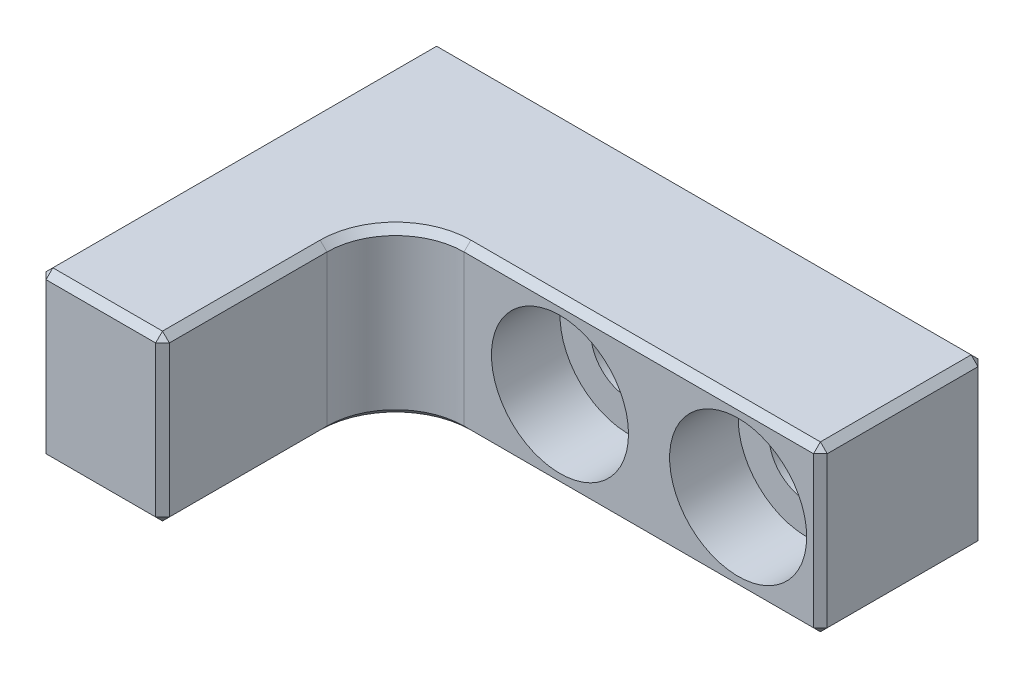
from build123d import *

# Parameters (mm, degrees)
SKETCH_1_W                   = 40
SKETCH_1_H                   = 12
EXTRUDE_1_DEPTH              = 12
SKETCH_2_W                   = 9
SKETCH_2_H                   = 12
EXTRUDE_2_DEPTH              = 17
FILLET_1_R                   = 5
HOLE_WIZARD_M5_1_D           = 5.5
HOLE_WIZARD_M5_1_CBORE_D     = 10
HOLE_WIZARD_M5_1_CBORE_DEPTH = 5
CHAMFER_1_SIZE               = 0.5


with BuildPart() as part:
    # 草图1 → 凸台-拉伸1 (new body)
    with BuildSketch(Plane.XY):
        with Locations((20, 6)):
            Rectangle(SKETCH_1_W, SKETCH_1_H)
    extrude(amount=EXTRUDE_1_DEPTH)

    # 草图2 → 凸台-拉伸2 (add)
    with BuildSketch(Plane.XY.offset(12)):
        with Locations((4.5, 6)):
            Rectangle(SKETCH_2_W, SKETCH_2_H)
    extrude(amount=EXTRUDE_2_DEPTH)

    # 圆角1
    fillet_1_edges = [part.edges().sort_by_distance(p)[0] for p in [
        (9, 6, 12),
    ]]
    fillet(fillet_1_edges, radius=FILLET_1_R)

    # M5 六角凹头螺钉的柱形沉头孔1 (through all)
    with Locations(Plane.XY.offset(12)):
        with Locations((34, 6), (21, 6)):
            CounterBoreHole(HOLE_WIZARD_M5_1_D / 2, HOLE_WIZARD_M5_1_CBORE_D / 2, HOLE_WIZARD_M5_1_CBORE_DEPTH)

    # 倒角1
    chamfer_1_edges = [part.edges().sort_by_distance(p)[0] for p in [
        (40, 6, 12),
        (27, 12, 12),
        (9, 0, 23),
        (9, 12, 23),
        (0, 6, 29),
        (4.5, 0, 29),
        (9, 6, 29),
        (4.5, 12, 29),
        (27, 0, 12),
        (10.464466094, 12, 13.464466094),
        (10.464466094, 0, 13.464466094),
        (20, 12, 0),
        (40, 6, 0),
        (20, 0, 0),
        (0, 6, 0),
        (0, 12, 14.5),
        (40, 12, 6),
        (40, 0, 6),
        (0, 0, 14.5),
    ]]
    chamfer(chamfer_1_edges, length=CHAMFER_1_SIZE)


solid = part.part
